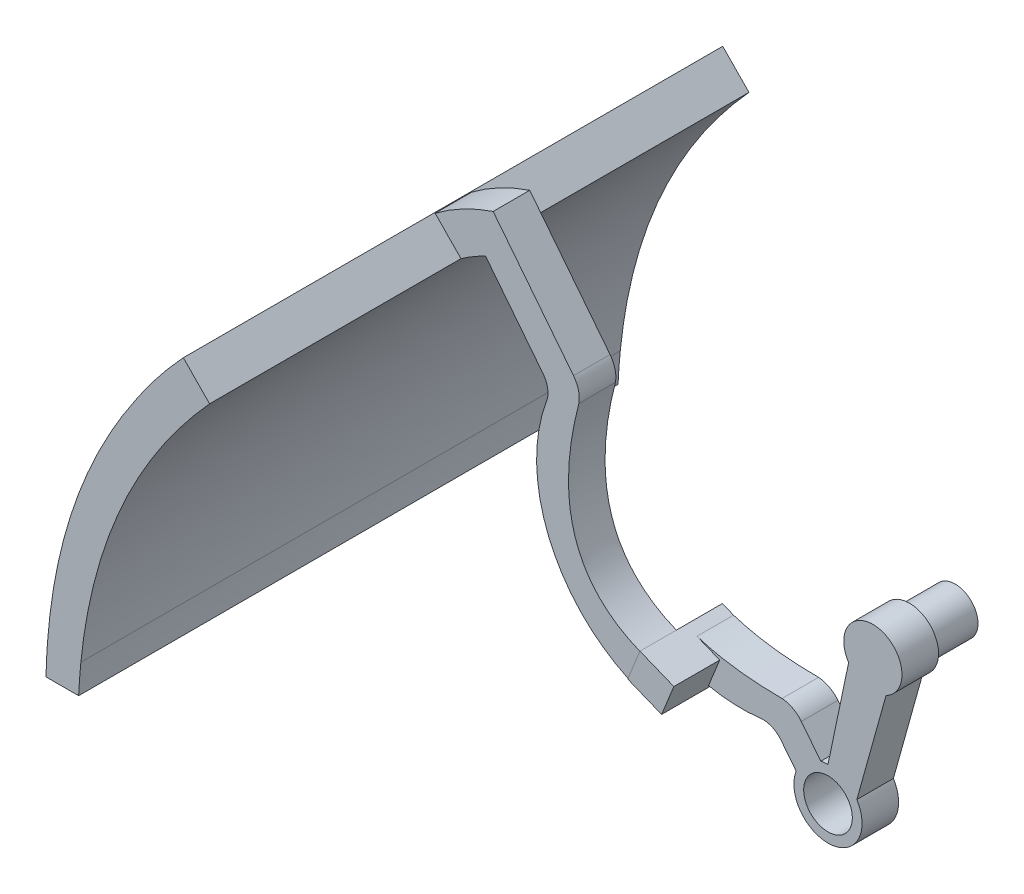
from build123d import *

# Parameters (mm, degrees)
BOSS_EXTRUDE1_DEPTH      = 74.93
BOSS_EXTRUDE4_DEPTH      = 2.54
BOSS_EXTRUDE4_DEPTH_BACK = 2.54
BOSS_EXTRUDE6_DEPTH      = 74.93
BOSS_EXTRUDE7_DEPTH      = 74.93
SKETCH11_R               = 3.3782
BOSS_EXTRUDE8_DEPTH      = 2.54
SKETCH12_R               = 3.175
BOSS_EXTRUDE9_DEPTH      = 11.43
SKETCH14_W               = 11.454369962
SKETCH14_H               = 4.541337636
BOSS_EXTRUDE10_DEPTH     = 5.08
SKETCH16_R               = 4.043569484
BOSS_EXTRUDE11_DEPTH     = 5.08


with BuildPart() as part:
    # Sketch1 → Boss-Extrude1 (new body)
    with BuildSketch(Plane.XY):
        with BuildLine():
            Line((-16.295773791, 0.624640473), (-12.907508233, 0.624640473))
            Line((-12.907508233, 0.624640473), (-12.443267089, 3.164640473))
            add(Edge.make_bspline(
                [(-12.443267089, 3.164640473), (-12.30668745, 3.911907895), (-11.89696139, 6.153716378), (-11.35075536, 9.142778811), (-10.941162808, 11.384616955), (-10.804635025, 12.131895145)],
                knots=[0.002076118, 0.002076118, 0.002076118, 0.002076118, 0.004355051, 0.008912916, 0.011191849, 0.011191849, 0.011191849, 0.011191849], degree=3))
            add(Edge.make_bspline(
                [(-10.804635025, 12.131895145), (-10.131787944, 14.813925559), (-8.428636773, 20.08894476), (-4.769918918, 27.602373316), (-0.882056925, 33.370017928), (2.696640916, 37.629074894), (4.663596703, 39.6688962), (5.677623009, 40.647244333)],
                knots=[-0.595137067, -0.595137067, -0.595137067, -0.595137067, -0.254899084, 0.0853389, 0.425576884, 0.595695875, 0.765814867, 0.765814867, 0.765814867, 0.765814867], degree=3))
            Line((5.677623009, 40.647244333), (2.03170084, 44.371046934))
            add(Edge.make_bspline(
                [(2.03170084, 44.371046934), (1.545061943, 43.849333503), (0.584048879, 42.784657511), (-1.227882281, 40.634272171), (-4.205920413, 36.737641226), (-7.868630072, 30.842728735), (-11.285075765, 23.259160615), (-12.891126954, 17.928422411), (-13.516382283, 15.22778531)],
                knots=[0.192222826, 0.192222826, 0.192222826, 0.192222826, 0.287167093, 0.38211136, 0.571999893, 0.951776961, 1.331554028, 1.711331096, 1.711331096, 1.711331096, 1.711331096], degree=3))
            add(Edge.make_bspline(
                [(-13.516382283, 15.22778531), (-13.707651088, 14.222513225), (-14.09021448, 12.211975656), (-14.664139503, 9.196174334), (-15.238140346, 6.180406911), (-15.620861993, 4.169893716), (-15.812232602, 3.164640473)],
                knots=[-0.00268258, -0.00268258, -0.00268258, -0.00268258, 0.000387339, 0.003457258, 0.006527177, 0.009597097, 0.009597097, 0.009597097, 0.009597097], degree=3))
            Line((-15.812232602, 3.164640473), (-16.295773791, 0.624640473))
        make_face()
    extrude(amount=BOSS_EXTRUDE1_DEPTH)

    # Sketch4 → Boss-Extrude4 (add, two sides: drawn at the far end of the back side and taken through both)
    with BuildSketch(Plane(origin=(0, 0, 37.465), x_dir=(-1, 0, 0), z_dir=(0, 0, -1)).offset(-BOSS_EXTRUDE4_DEPTH_BACK)):
        with BuildLine():
            Line((-5.677623009, 40.647244333), (-2.087143894, 44.314419562))
            ThreePointArc((-2.087143894, 44.314419562), (-5.945357936, 46.761917563), (-10.144870483, 48.561961011))
            Line((-10.144870483, 48.561961011), (-12.342217859, 43.933321468))
            ThreePointArc((-12.342217859, 43.933321468), (-8.878894593, 42.556020468), (-5.677623009, 40.647244333))
        make_face()
    extrude(amount=BOSS_EXTRUDE4_DEPTH + BOSS_EXTRUDE4_DEPTH_BACK)

    # Sketch8 → Boss-Extrude6 (add)
    with BuildSketch(Plane(origin=(0, 0, 0), x_dir=(-1, 0, 0), z_dir=(0, 0, -1))):
        with BuildLine():
            Line((12.199993526, 0.628671187), (16.843743367, 0.628671187))
            add(Edge.make_bspline(
                [(-2.03170084, 44.371046934), (15.008940659, 25.494574417), (16.843743367, 0.628671187)],
                knots=[0, 0, 0, 1, 1, 1], degree=2))
            Line((-2.03170084, 44.371046934), (-5.677623009, 40.647244333))
            add(Edge.make_bspline(
                [(-5.677623009, 40.647244333), (9.879032096, 23.52153238), (12.199993526, 0.628671187)],
                knots=[0, 0, 0, 1, 1, 1], degree=2))
        make_face()
    extrude(amount=-BOSS_EXTRUDE6_DEPTH)

    # Sketch10 → Boss-Extrude7 (add)
    with BuildSketch(Plane.XY.offset(74.93)):
        with BuildLine():
            add(Edge.make_bspline(
                [(-17.044210577, -3.569022053), (-16.99706974, -1.449262713), (-16.843743367, 0.628671187)],
                knots=[0, 0, 0, 1, 1, 1], degree=2))
            Line((-16.843743367, 0.628671187), (-16.295006462, 0.628671187))
            Line((-16.295006462, 0.628671187), (-16.295773791, 0.624640473))
            Line((-16.295773791, 0.624640473), (-12.907508233, 0.624640473))
            Line((-12.907508233, 0.624640473), (-12.906771531, 0.628671187))
            Line((-12.906771531, 0.628671187), (-12.199993526, 0.628671187))
            add(Edge.make_bspline(
                [(-12.199993526, 0.628671187), (-12.410380076, -1.44648182), (-12.512012235, -3.569022053)],
                knots=[0, 0, 0, 1, 1, 1], degree=2))
            Line((-12.512012235, -3.569022053), (-17.044210577, -3.569022053))
        make_face()
    extrude(amount=-BOSS_EXTRUDE7_DEPTH)

    # Sketch11 → Boss-Extrude8 (add, symmetric)
    with BuildSketch(Plane(origin=(0, 0, 37.465), x_dir=(-1, 0, 0), z_dir=(0, 0, -1))):
        with BuildLine():
            Line((-6.661648357, 45.739913105), (-10.144870483, 48.561961011))
            Line((-10.144870483, 48.561961011), (-21.306209309, 34.387494774))
            ThreePointArc((-21.306209309, 34.387494774), (-21.997885217, 32.978248014), (-22.052439991, 31.409358033))
            add(Edge.make_bspline(
                [(-43.921175132, 3.682891736), (-14.804010115, 3.685410597), (-22.052439991, 31.409358033)],
                knots=[0, 0, 0, 1, 1, 1], degree=2))
            ThreePointArc((-43.921175132, 3.682891736), (-45.412252296, 3.255494908), (-46.603036961, 2.261507464))
            Line((-46.603036961, 2.261507464), (-49.3060524, -1.171217021))
            ThreePointArc((-49.3060524, -1.171217021), (-49.803661042, -1.091013739), (-50.306976812, -1.06417788))
            Line((-50.306976812, -1.06417788), (-53.763973591, 15.454073405))
            ThreePointArc((-53.763973591, 15.454073405), (-56.832870033, 17.694796121), (-59.377686579, 14.872939923))
            Line((-59.377686579, 14.872939923), (-54.315487208, -3.280299501))
            ThreePointArc((-54.315487208, -3.280299501), (-50.756874344, -10.509444763), (-45.894543202, -4.084337558))
            Line((-45.894543202, -4.084337558), (-43.766648862, -1.381994502))
            ThreePointArc((-43.766648862, -1.381994502), (-42.486290668, -0.41252926), (-40.895291759, -0.193663017))
            ThreePointArc((-40.895291759, -0.193663017), (-20.913927056, 8.075766362), (-17.561546975, 29.439285396))
            ThreePointArc((-17.561546975, 29.439285396), (-17.72193531, 31.037238944), (-17.079804086, 32.509260496))
            Line((-17.079804086, 32.509260496), (-11.95129503, 39.022267547))
            Line((-11.95129503, 39.022267547), (-6.661648357, 45.739913105))
        make_face()
        with Locations((-50.306976812, -5.797526095)):
            Circle(SKETCH11_R, mode=Mode.SUBTRACT)
    extrude(amount=BOSS_EXTRUDE8_DEPTH, both=True)

    # Sketch12 → Boss-Extrude9 (add)
    with BuildSketch(Plane.XY.offset(40.005)):
        with Locations((56.540750517, 14.872939923)):
            Circle(SKETCH12_R)
    extrude(amount=-BOSS_EXTRUDE9_DEPTH)


with BuildPart() as body_2:
    # Split1: the piece on the far side of the plane
    add(part.part)
    split(bisect_by=Plane(origin=(24.222018339, -9.793178229, 0), x_dir=(-0.37483189290442787, -0.9270927958201831, 0), z_dir=(-0.9270927958201831, 0.37483189290442787, 0)), keep=Keep.BOTTOM)


with BuildPart() as part_1:
    add(part.part)

    # Split1
    split(bisect_by=Plane(origin=(24.222018339, -9.793178229, 0), x_dir=(-0.37483189290442787, -0.9270927958201831, 0), z_dir=(-0.9270927958201831, 0.37483189290442787, 0)), keep=Keep.TOP)



with BuildPart() as body_2_1:
    # Body-Move/Copy1: moved
    add(body_2.part.moved(Location((0, 0, -6.35))))


with BuildPart() as part_2:
    add(part_1.part)

    add(body_2_1.part)  # Boss-Extrude10 merges body 2
    # Sketch14 → Boss-Extrude10 (add)
    with BuildSketch(Plane(origin=(24.222018339, -9.793178229, 0), x_dir=(0, 0, -1), z_dir=(0.9270927958201831, -0.37483189290442787, 0))):
        with Locations((-34.301669156, 14.639573878)):
            Rectangle(SKETCH14_W, SKETCH14_H)
    extrude(amount=BOSS_EXTRUDE10_DEPTH)

    # Sketch16 → Boss-Extrude11 (add)
    with BuildSketch(Plane(origin=(0, 0, 28.575), x_dir=(-1, 0, 0), z_dir=(0, 0, -1))):
        with Locations((-56.540750517, 14.872939923)):
            Circle(SKETCH16_R)
    extrude(amount=-BOSS_EXTRUDE11_DEPTH)


solid = part_2.part
